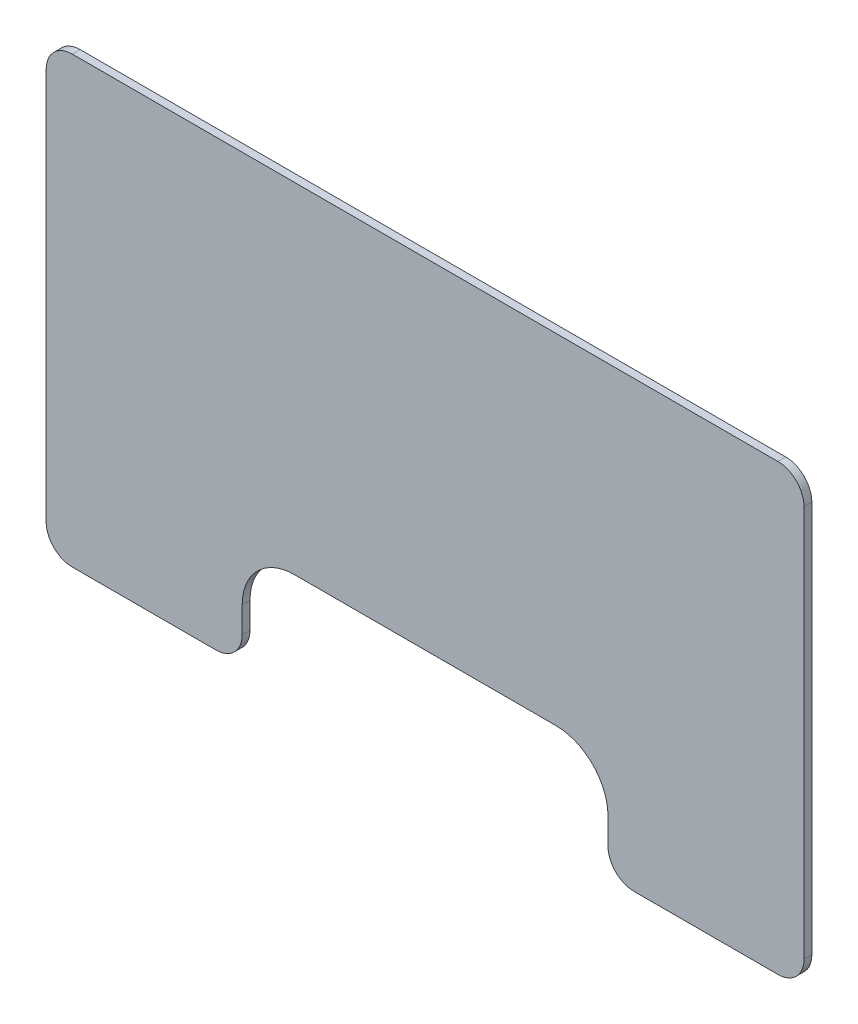
from build123d import *

# Parameters (mm, degrees)
EXTRUDE_1_DEPTH = 1.5


with BuildPart() as part:
    # Эскиз1 → Бобышка-Вытянуть1 (new body)
    with BuildSketch(Plane.XY):
        with BuildLine():
            Line((-5, 0), (-32.5, 0))
            ThreePointArc((-32.5, 0), (-36.035533906, 1.464466094), (-37.5, 5))
            Line((-37.5, 5), (-37.5, 10))
            ThreePointArc((-37.5, 10), (-40.428932188, 17.071067812), (-47.5, 20))
            Line((-47.5, 20), (-97.5, 20))
            ThreePointArc((-97.5, 20), (-104.571067812, 17.071067812), (-107.5, 10))
            Line((-107.5, 10), (-107.5, 5))
            ThreePointArc((-107.5, 5), (-108.964466094, 1.464466094), (-112.5, 0))
            Line((-112.5, 0), (-140, 0))
            ThreePointArc((-140, 0), (-143.535533906, 1.464466094), (-145, 5))
            Line((-145, 5), (-145, 80))
            ThreePointArc((-145, 80), (-143.535533906, 83.535533906), (-140, 85))
            Line((-140, 85), (-5, 85))
            ThreePointArc((-5, 85), (-1.464466094, 83.535533906), (0, 80))
            Line((0, 80), (0, 5))
            ThreePointArc((0, 5), (-1.464466094, 1.464466094), (-5, 0))
        make_face()
    extrude(amount=EXTRUDE_1_DEPTH)


solid = part.part
